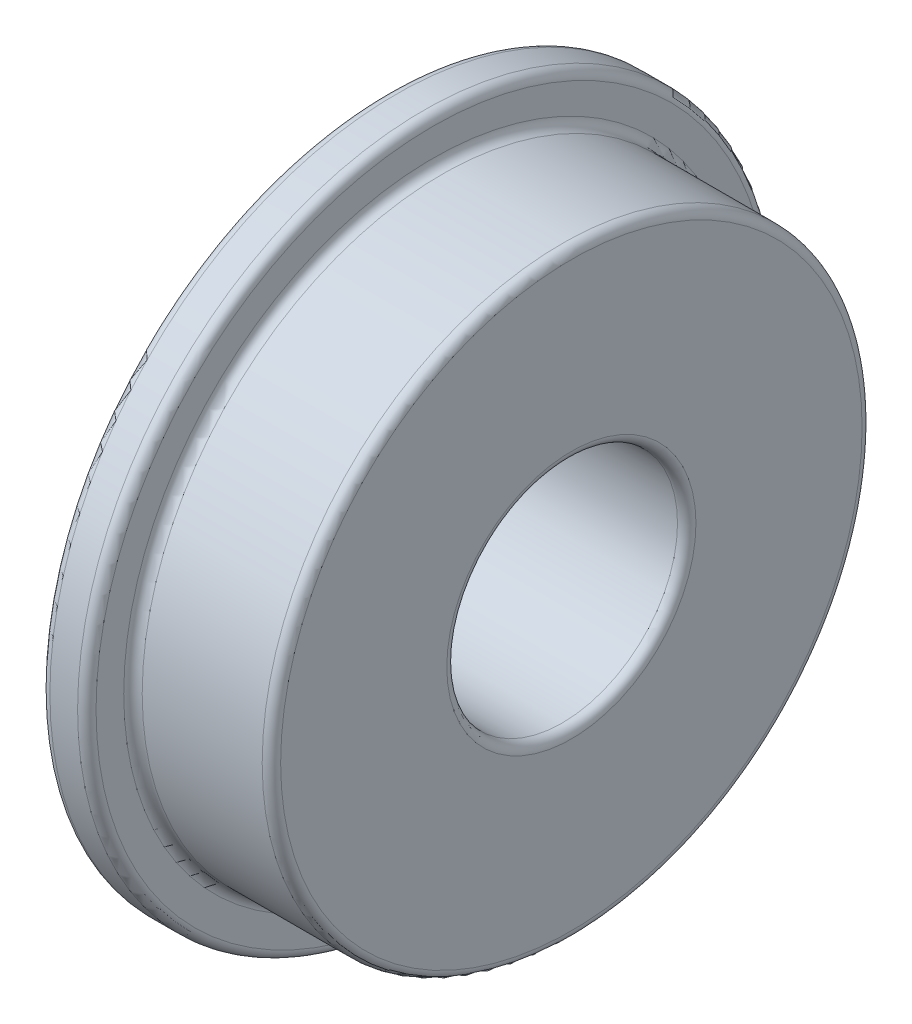
from build123d import *

# Parameters (mm, degrees)
FILLET1_R = 0.2


with BuildPart() as part:
    # Main Revolve Sketch → Main Revolve (revolve)
    with BuildSketch(Plane.XY, mode=Mode.PRIVATE) as main_revolve_sk:
        Polygon((0, 2.5), (4, 2.5), (4, 6.5), (1, 6.5), (1, 7.5), (0, 7.5), align=None)
    revolve(main_revolve_sk.sketch.rotate(Axis((0, 0, 0), (1, 0, 0)), 90), axis=Axis((0, 0, 0), (1, 0, 0)))

    # Fillet1
    fillet1_edges = [part.edges().sort_by_distance(p)[0] for p in [
        (0, 0, -7.5),
        (1, 0, -7.5),
        (1, 0, -6.5),
        (4, 0, -6.5),
        (4, 0, -2.5),
        (0, 0, -2.5),
    ]]
    fillet(fillet1_edges, radius=FILLET1_R)


solid = part.part
